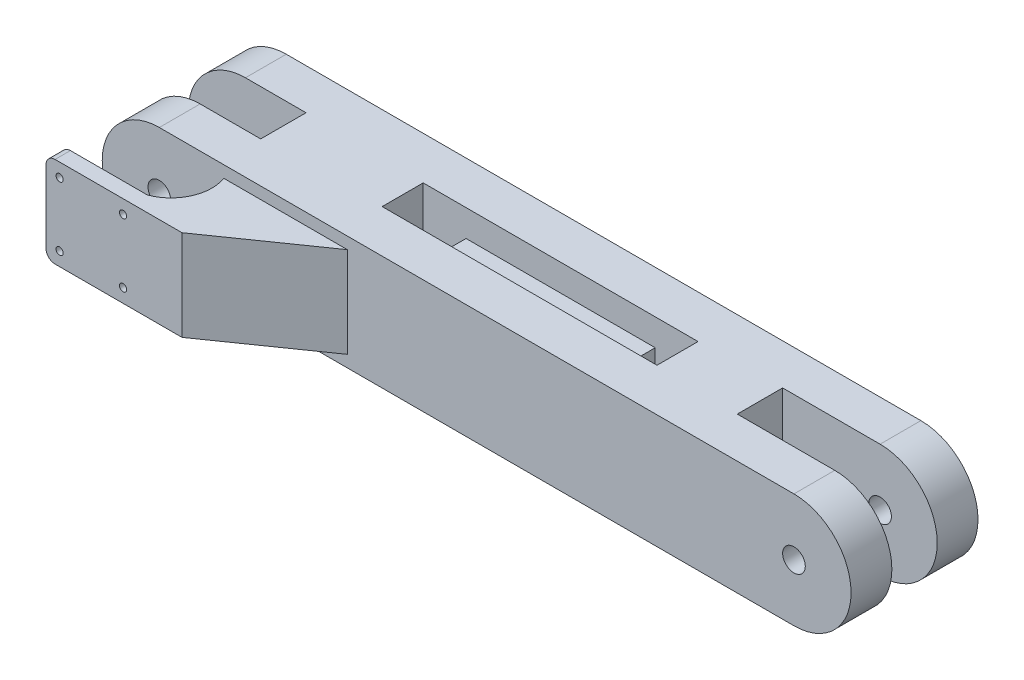
from build123d import *

# Parameters (mm, degrees)
SKETCH1_R           = 3.175
BOSS_EXTRUDE1_DEPTH = 11.43
SKETCH2_W           = 161.464261653
SKETCH2_H           = 32
BOSS_EXTRUDE2_DEPTH = 12.7
SKETCH5_R           = 3.175
BOSS_EXTRUDE3_DEPTH = 11.43
SKETCH6_W           = 77
SKETCH6_H           = 11.5
CUT_EXTRUDE1_DEPTH  = 7.5
BOSS_EXTRUDE4_DEPTH = 19.05
CUT_EXTRUDE3_DEPTH  = 30.48
BOSS_EXTRUDE5_DEPTH = 25.4
SKETCH7_W           = 12
SKETCH7_H           = 11.5
CUT_EXTRUDE4_DEPTH  = 50.8
SKETCH7_5_W         = 12
SKETCH7_5_H         = 11.5
CUT_EXTRUDE5_DEPTH  = 50.8
SKETCH16_W          = 12.7
SKETCH16_H          = 32
CUT_EXTRUDE6_DEPTH  = 8.89
SKETCH17_R          = 1
CUT_EXTRUDE7_DEPTH  = 4.299778595
SKETCH18_W          = 12.7
SKETCH18_H          = 32
CUT_EXTRUDE8_DEPTH  = 19.05
CUT_EXTRUDE9_DEPTH  = 3.81


with BuildPart() as part:
    # Sketch1 → Boss-Extrude1 (new body)
    with BuildSketch(Plane.XY):
        with BuildLine():
            Line((-47.217391304, 7.923913043), (130.582608696, 7.923913043))
            ThreePointArc((130.582608696, 7.923913043), (146.582608696, -8.076086957), (130.582608696, -24.076086957))
            Line((130.582608696, -24.076086957), (-47.217391304, -24.076086957))
            ThreePointArc((-47.217391304, -24.076086957), (-63.217391304, -8.076086957), (-47.217391304, 7.923913043))
        make_face()
        with Locations((-47.217391304, -8.076086957)):
            Circle(SKETCH1_R, mode=Mode.SUBTRACT)
        with Locations((130.582608696, -8.076086957)):
            Circle(SKETCH1_R, mode=Mode.SUBTRACT)
    extrude(amount=BOSS_EXTRUDE1_DEPTH)

    # Sketch2 → Boss-Extrude2 (add)
    with BuildSketch(Plane.XY.offset(11.43)):
        with Locations((41.59547787, -8.076086957)):
            Rectangle(SKETCH2_W, SKETCH2_H)
    extrude(amount=BOSS_EXTRUDE2_DEPTH)

    # Sketch5 → Boss-Extrude3 (add)
    with BuildSketch(Plane.XY.offset(24.13)):
        with BuildLine():
            Line((-47.217391304, 7.923913043), (130.582608696, 7.923913043))
            ThreePointArc((130.582608696, 7.923913043), (146.582608696, -8.076086957), (130.582608696, -24.076086957))
            Line((130.582608696, -24.076086957), (-47.217391304, -24.076086957))
            ThreePointArc((-47.217391304, -24.076086957), (-63.217391304, -8.076086957), (-47.217391304, 7.923913043))
        make_face()
        with Locations((-47.217391304, -8.076086957)):
            Circle(SKETCH5_R, mode=Mode.SUBTRACT)
        with Locations((130.582608696, -8.076086957)):
            Circle(SKETCH5_R, mode=Mode.SUBTRACT)
    extrude(amount=BOSS_EXTRUDE3_DEPTH)

    # Sketch6 → Cut-Extrude1 (cut)
    with BuildSketch(Plane(origin=(0, 7.923913043, 0), x_dir=(1, 0, 0), z_dir=(0, 1, 0))):
        with Locations((41.682608696, -17.78)):
            Rectangle(SKETCH6_W, SKETCH6_H)
    extrude(amount=-CUT_EXTRUDE1_DEPTH, mode=Mode.SUBTRACT)

    # Sketch10 → Boss-Extrude4 (add)
    with BuildSketch(Plane.XY.offset(35.56)):
        with BuildLine():
            Line((-34.517391304, -20.776086957), (-57.377391304, -20.776086957))
            ThreePointArc((-57.377391304, -20.776086957), (-59.173442529, -20.032138181), (-59.917391304, -18.236086957))
            Line((-59.917391304, -18.236086957), (-59.917391304, 2.083913043))
            ThreePointArc((-59.917391304, 2.083913043), (-59.173442529, 3.879964268), (-57.377391304, 4.623913043))
            Line((-57.377391304, 4.623913043), (-34.517391304, 4.623913043))
            Line((-34.517391304, 4.623913043), (-21.817391304, 4.623913043))
            Line((-21.817391304, 4.623913043), (-21.817391304, -20.776086957))
            Line((-21.817391304, -20.776086957), (-34.517391304, -20.776086957))
        make_face()
    extrude(amount=BOSS_EXTRUDE4_DEPTH)

    # Sketch14 → Cut-Extrude3 (cut)
    with BuildSketch(Plane(origin=(0, 4.623913043, 0), x_dir=(1, 0, 0), z_dir=(0, 1, 0))):
        with BuildLine():
            Line((-59.917391304, -35.56), (-29.183391304, -35.56))
            ThreePointArc((-29.183391304, -35.56), (-29.434604535, -44.304535578), (-35.79555952, -50.310221405))
            Line((-35.79555952, -50.310221405), (-59.917391304, -50.310221405))
            Line((-59.917391304, -50.310221405), (-59.917391304, -35.56))
        make_face()
    extrude(amount=-CUT_EXTRUDE3_DEPTH, mode=Mode.SUBTRACT)

    # Sketch15 → Boss-Extrude5 (add)
    with BuildSketch(Plane.XZ.offset(20.776086957)):
        Polygon((-21.817391304, 35.56), (5.46367495, 35.56), (-21.817391304, 54.61), align=None)
    extrude(amount=-BOSS_EXTRUDE5_DEPTH)

    # Sketch7 → Cut-Extrude4 (cut)
    with BuildSketch(Plane(origin=(0, 0.423913043, 0), x_dir=(1, 0, 0), z_dir=(0, 1, 0))):
        with Locations((74.182608696, -17.78)):
            Rectangle(SKETCH7_W, SKETCH7_H)
    extrude(amount=-CUT_EXTRUDE4_DEPTH, mode=Mode.SUBTRACT)

    # Sketch7<5> → Cut-Extrude5 (cut)
    with BuildSketch(Plane(origin=(0, 0.423913043, 0), x_dir=(1, 0, 0), z_dir=(0, 1, 0))):
        with Locations((9.182608696, -17.78)):
            Rectangle(SKETCH7_5_W, SKETCH7_5_H)
    extrude(amount=-CUT_EXTRUDE5_DEPTH, mode=Mode.SUBTRACT)

    # Sketch16 → Cut-Extrude6 (cut)
    with BuildSketch(Plane.ZY.offset(39.136652957)):
        with Locations((17.78, -8.076086957)):
            Rectangle(SKETCH16_W, SKETCH16_H)
    extrude(amount=-CUT_EXTRUDE6_DEPTH, mode=Mode.SUBTRACT)

    # Sketch17 → Cut-Extrude7 (cut)
    with BuildSketch(Plane(origin=(0, 0, 50.310221405), x_dir=(-1, 0, 0), z_dir=(0, 0, -1))):
        with Locations((38.327391304, 0.813913043)):
            Circle(SKETCH17_R)
        with Locations((56.107391304, 0.813913043)):
            Circle(SKETCH17_R)
        with Locations((56.107391304, -16.966086957)):
            Circle(SKETCH17_R)
        with Locations((38.327391304, -16.966086957)):
            Circle(SKETCH17_R)
    extrude(amount=-CUT_EXTRUDE7_DEPTH, mode=Mode.SUBTRACT)

    # Sketch18 → Cut-Extrude8 (cut)
    with BuildSketch(Plane(origin=(122.327608696, 0, 0), x_dir=(0, 0, -1), z_dir=(1, 0, 0))):
        with Locations((-17.78, -8.076086957)):
            Rectangle(SKETCH18_W, SKETCH18_H)
    extrude(amount=-CUT_EXTRUDE8_DEPTH, mode=Mode.SUBTRACT)

    # Sketch19 → Cut-Extrude9 (cut)
    with BuildSketch(Plane(origin=(0, 0, 0), x_dir=(-1, 0, 0), z_dir=(0, 0, -1))):
        Polygon((-130.582608696, -1.47697338), (-136.297608696, -4.776530168), (-136.297608696, -11.375643745), (-130.582608696, -14.675200533), (-124.867608696, -11.375643745), (-124.867608696, -4.776530168), align=None)
    extrude(amount=-CUT_EXTRUDE9_DEPTH, mode=Mode.SUBTRACT)


solid = part.part
